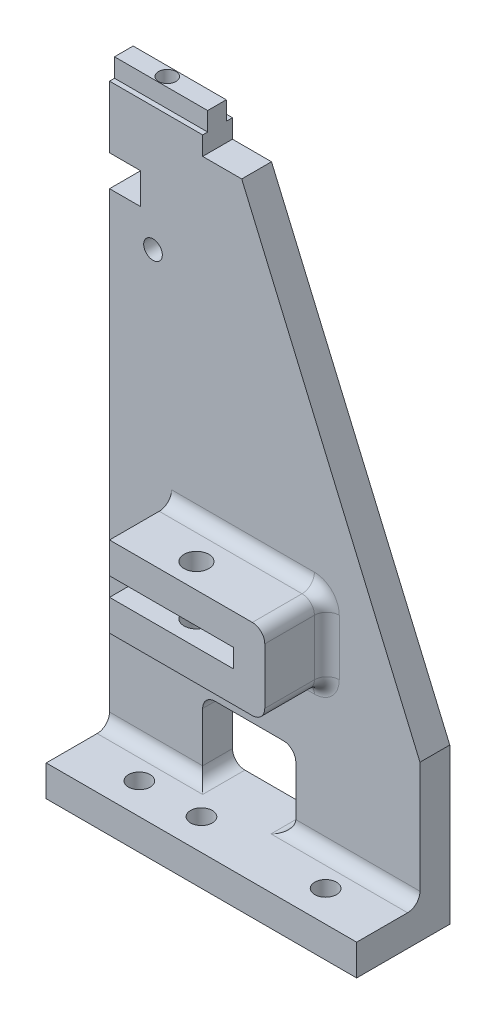
from build123d import *

# Parameters (mm, degrees)
SKETCH_1_R          = 1.5
EXTRUDE_1_DEPTH     = 4.8
SKETCH_2_W          = 50
SKETCH_2_H          = 15
SKETCH_2_R          = 1.75
EXTRUDE_2_DEPTH     = 5
EXTRUDE_3_DEPTH     = 10
SKETCH_5_R          = 2
CUT_EXTRUDE_1_DEPTH = 20
FILLET_1_R          = 2
FILLET_2_R          = 2
FILLET_3_R          = 2
SKETCH_6_W          = 15
SKETCH_6_H          = 3
EXTRUDE_5_DEPTH     = 3
SKETCH_7_R          = 1.4
CUT_EXTRUDE_2_DEPTH = 5
CUT_EXTRUDE_3_DEPTH = 73.079801494


with BuildPart() as part:
    # 草图1 → 凸台-拉伸1 (new body)
    with BuildSketch(Plane.XY):
        Polygon((-23.337979748, 53.186059405), (-23.337979748, 63.186059405), (-3.337979748, 63.186059405), (26.662020252, -6.813940595), (26.662020252, -26.813940595), (6.662020252, -26.813940595), (6.662020252, -14.813940595), (-8.337979748, -14.813940595), (-8.337979748, -26.813940595), (-23.337979748, -26.813940595), (-23.337979748, -6.813940595), (-23.337979748, 48.186059405), (-18.337979748, 48.186059405), (-18.337979748, 53.186059405), align=None)
        with Locations((-16.337979748, 43.186059405)):
            Circle(SKETCH_1_R, mode=Mode.SUBTRACT)
    extrude(amount=EXTRUDE_1_DEPTH)

    # 草图2 → 凸台-拉伸2 (add)
    with BuildSketch(Plane.XZ.offset(26.813940595)):
        with Locations((1.662020252, 7.5)):
            Rectangle(SKETCH_2_W, SKETCH_2_H)
        with Locations(Location((-13.337979748, 10, 0), (0, 0, 270))):
            Circle(SKETCH_2_R, mode=Mode.SUBTRACT)
        with Locations(Location((16.662020252, 10, 0), (0, 0, 270))):
            Circle(SKETCH_2_R, mode=Mode.SUBTRACT)
        with Locations(Location((-3.337979748, 10, 0), (0, 0, 270))):
            Circle(SKETCH_2_R, mode=Mode.SUBTRACT)
    extrude(amount=EXTRUDE_2_DEPTH)

    # 草图4 → 凸台-拉伸3 (add)
    with BuildSketch(Plane.XY.offset(4.8)):
        Polygon((11.662020252, 9.186059405), (11.662020252, -3.813940595), (-13.337979748, -3.813940595), (-13.337979748, 1.186059405), (6.662020252, 1.186059405), (6.662020252, 4.186059405), (-3.337979748, 4.186059405), (-13.337979748, 4.186059405), (-13.337979748, 9.186059405), align=None)
    extrude(amount=EXTRUDE_3_DEPTH)

    # 草图5 → 切除-拉伸1 (cut)
    with BuildSketch(Plane(origin=(0, 9.186059405, 0), x_dir=(1, 0, 0), z_dir=(0, 1, 0))):
        with Locations(Location((-3.337979748, -10.8, 0), (0, 0, 270))):
            Circle(SKETCH_5_R)
    extrude(amount=-CUT_EXTRUDE_1_DEPTH, mode=Mode.SUBTRACT)

    # 圆角1
    fillet_1_edges = [part.edges().sort_by_distance(p)[0] for p in [
        (11.662020252, -3.813940595, 9.8),
        (11.662020252, 9.186059405, 9.8),
    ]]
    fillet(fillet_1_edges, radius=FILLET_1_R)

    # 圆角2
    fillet_2_edges = [part.edges().sort_by_distance(p)[0] for p in [
        (-1.837979748, 9.186059405, 4.8),
        (11.076233814, -3.228154158, 4.8),
        (11.076233814, 8.600272967, 4.8),
        (-1.837979748, -3.813940595, 4.8),
        (11.662020252, 2.686059405, 4.8),
    ]]
    fillet(fillet_2_edges, radius=FILLET_2_R)

    # 圆角3
    fillet_3_edges = [part.edges().sort_by_distance(p)[0] for p in [
        (-15.837979748, -26.813940595, 4.8),
        (6.662020252, -26.813940595, 2.4),
        (6.662020252, -14.813940595, 2.4),
        (-8.337979748, -14.813940595, 2.4),
        (-8.337979748, -26.813940595, 2.4),
        (16.662020252, -26.813940595, 4.8),
    ]]
    fillet(fillet_3_edges, radius=FILLET_3_R)

    # 草图6 → 凸台-拉伸5 (add)
    with BuildSketch(Plane(origin=(0, 63.186059405, 0), x_dir=(1, 0, 0), z_dir=(0, 1, 0))):
        with Locations((-15.837979748, -2.5)):
            Rectangle(SKETCH_6_W, SKETCH_6_H)
    extrude(amount=EXTRUDE_5_DEPTH)

    # 草图7 → 切除-拉伸2 (cut)
    with BuildSketch(Plane(origin=(0, 66.186059405, 0), x_dir=(1, 0, 0), z_dir=(0, 1, 0))):
        with Locations(Location((-16.337979748, -2.5, 0), (0, 0, 270))):
            Circle(SKETCH_7_R)
    extrude(amount=-CUT_EXTRUDE_2_DEPTH, mode=Mode.SUBTRACT)

    # 草图8 → 切除-拉伸3 (cut, through all)
    with BuildSketch(Plane.XY.offset(4.8)):
        Polygon((-8.337979748, 63.186059405), (-8.337979748, 60.186059405), (-2.052265462, 60.186059405), (-3.337979748, 63.186059405), align=None)
    extrude(amount=-CUT_EXTRUDE_3_DEPTH, mode=Mode.SUBTRACT)


solid = part.part
